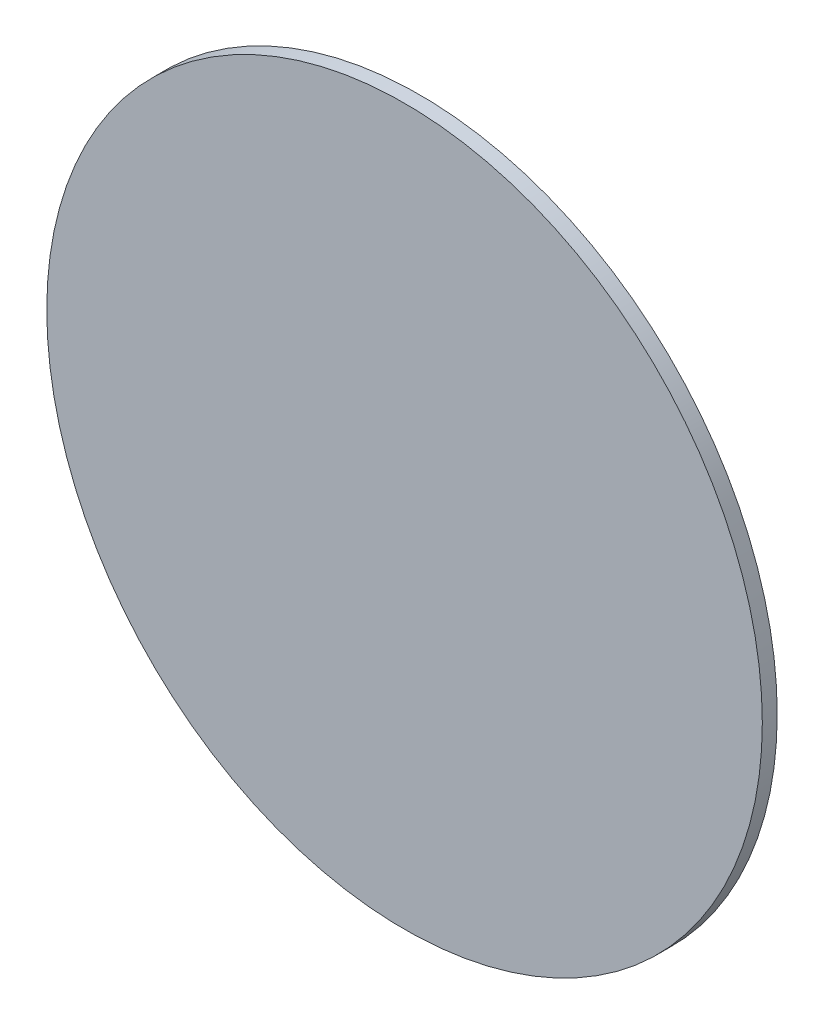
from build123d import *

# Parameters (mm, degrees)
SKETCH_1_R      = 24
EXTRUDE_1_DEPTH = 1


with BuildPart() as part:
    # Эскиз1 → Бобышка-Вытянуть1 (new body)
    with BuildSketch(Plane.XY):
        Circle(SKETCH_1_R)
    extrude(amount=EXTRUDE_1_DEPTH)


solid = part.part
